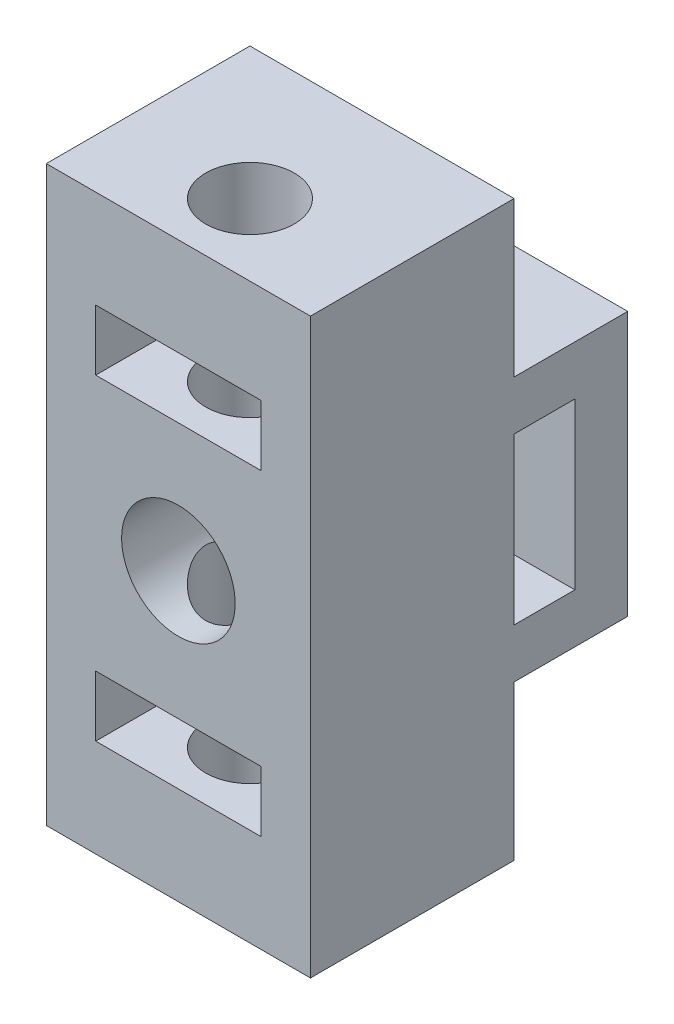
from build123d import *

# Parameters (mm, degrees)
SKETCH1_W               = 10
SKETCH1_H               = 10
BOSS_EXTRUDE1_DEPTH     = 5
CUT_EXTRUDE1_DEPTH      = 9.660254038
CUT_EXTRUDE1_DEPTH_BACK = 9.660254038
SKETCH2_R               = 1.675
SKETCH3_R               = 1.675
CUT_EXTRUDE3_DEPTH      = 2.3
SKETCH4_W               = 10
SKETCH4_H               = 10
BOSS_EXTRUDE2_DEPTH     = 2.7
SKETCH6_W               = 10
SKETCH6_H               = 10
BOSS_EXTRUDE3_DEPTH     = 7
SKETCH9_R               = 2.15
CUT_EXTRUDE12_DEPTH     = 19.468622038
SKETCH10_R              = 1.675
CUT_EXTRUDE13_DEPTH     = 13.003749414
BOSS_EXTRUDE4_DEPTH     = 2.3
SKETCH12_W              = 10
SKETCH12_H              = 10
BOSS_EXTRUDE5_DEPTH     = 2.7
CUT_EXTRUDE14_START     = -2.7
SKETCH13_R              = 1.675
CUT_EXTRUDE14_DEPTH     = 2.7
SKETCH14_R              = 2.15
BOSS_EXTRUDE6_DEPTH     = 0.76
SKETCH16_W              = 10
SKETCH16_H              = 19.7
CUT_EXTRUDE15_DEPTH     = 2.29
BOSS_EXTRUDE7_START     = 1
SKETCH17_W              = 10
SKETCH17_H              = 7.71
SKETCH17_R              = 1.675
BOSS_EXTRUDE7_DEPTH     = 1
SKETCH18_W              = 10
SKETCH18_H              = 7.71
SKETCH18_R              = 1.675
BOSS_EXTRUDE9_DEPTH     = 1
BOSS_EXTRUDE13_DEPTH    = 2.3
SKETCH23_W              = 10
SKETCH23_H              = 10
SKETCH23_R              = 1.675
BOSS_EXTRUDE15_DEPTH    = 2


with BuildPart() as part:
    # Sketch1 → Boss-Extrude1 (new body)
    with BuildSketch(Plane(origin=(0, 0, 0), x_dir=(1, 0, 0), z_dir=(0, 1, 0))):
        Rectangle(SKETCH1_W, SKETCH1_H)
    extrude(amount=BOSS_EXTRUDE1_DEPTH)

    # Sketch2 → Cut-Extrude1 (cut, two sides: drawn at the far end of the back side and taken through both)
    with BuildSketch(Plane(origin=(0, 5, 0), x_dir=(1, 0, 0), z_dir=(0, 1, 0)).offset(-CUT_EXTRUDE1_DEPTH_BACK)):
        with Locations(Location((0, 0, 0), (0, 0, 270))):
            Circle(SKETCH2_R)
    extrude(amount=CUT_EXTRUDE1_DEPTH + CUT_EXTRUDE1_DEPTH_BACK, mode=Mode.SUBTRACT)

    # Sketch3 → Cut-Extrude3 (cut)
    # profile 1 of 2: a face of its own
    with BuildSketch(Plane(origin=(0, 5, 0), x_dir=(1, 0, 0), z_dir=(0, 1, 0))):
        Polygon((-1.56461923, -2.71), (1.56461923, -2.71), (3.129238459, 0), (1.56461923, 2.71), (-1.56461923, 2.71), (-3.129238459, 0), align=None)
        with Locations(Location((0, 0, 0), (0, 0, 270))):
            Circle(SKETCH3_R, mode=Mode.SUBTRACT)
    # profile 2 of 2: a face of its own
    with BuildSketch(Plane(origin=(0, 5, 0), x_dir=(1, 0, 0), z_dir=(0, 1, 0))):
        Polygon((-1.56461923, -2.71), (-3.129238459, 0), (-3.129238459, -5), (3.129238459, -5), (3.129238459, 0), (1.56461923, -2.71), align=None)
    extrude(amount=-CUT_EXTRUDE3_DEPTH, mode=Mode.SUBTRACT)

    # Sketch4 → Boss-Extrude2 (add)
    with BuildSketch(Plane(origin=(0, 5, 0), x_dir=(1, 0, 0), z_dir=(0, 1, 0))):
        Rectangle(SKETCH4_W, SKETCH4_H)
    extrude(amount=BOSS_EXTRUDE2_DEPTH)

    # Sketch6 → Boss-Extrude3 (add)
    with BuildSketch(Plane(origin=(0, 7.7, 0), x_dir=(1, 0, 0), z_dir=(0, 1, 0))):
        Rectangle(SKETCH6_W, SKETCH6_H)
    extrude(amount=BOSS_EXTRUDE3_DEPTH)

    # Sketch9 → Cut-Extrude12 (cut, through all)
    with BuildSketch(Plane(origin=(0, 0, -5), x_dir=(-1, 0, 0), z_dir=(0, 0, -1))):
        with Locations((0, 9.85)):
            Circle(SKETCH9_R)
    extrude(amount=-CUT_EXTRUDE12_DEPTH, mode=Mode.SUBTRACT)

    # Sketch10 → Cut-Extrude13 (cut, through all)
    with BuildSketch(Plane.XZ.offset(-5)):
        with Locations(Location((0, 0, 0), (0, 0, 90))):
            Circle(SKETCH10_R)
    extrude(amount=-CUT_EXTRUDE13_DEPTH, mode=Mode.SUBTRACT)

    # Sketch11 → Boss-Extrude4 (add)
    with BuildSketch(Plane(origin=(0, 14.7, 0), x_dir=(1, 0, 0), z_dir=(0, 1, 0))):
        Polygon((1.56461923, 2.71), (3.129238459, 0), (3.129238459, -5), (5, -5), (5, 5), (-5, 5), (-5, -5), (-3.129238459, -5), (-3.129238459, 0), (-1.56461923, 2.71), align=None)
    extrude(amount=BOSS_EXTRUDE4_DEPTH)

    # Sketch12 → Boss-Extrude5 (add)
    with BuildSketch(Plane(origin=(0, 17, 0), x_dir=(1, 0, 0), z_dir=(0, 1, 0))):
        Rectangle(SKETCH12_W, SKETCH12_H)
    extrude(amount=BOSS_EXTRUDE5_DEPTH)

    # Sketch13 → Cut-Extrude14 (cut)
    with BuildSketch(Plane(origin=(0, 19.7, 0), x_dir=(1, 0, 0), z_dir=(0, 1, 0)).offset(CUT_EXTRUDE14_START)):
        with Locations(Location((0, 0, 0), (0, 0, 270))):
            Circle(SKETCH13_R)
    extrude(amount=CUT_EXTRUDE14_DEPTH, mode=Mode.SUBTRACT)

    # Sketch16 → Cut-Extrude15 (cut)
    with BuildSketch(Plane.XY.offset(5)):
        with Locations((0, 9.85)):
            Rectangle(SKETCH16_W, SKETCH16_H)
    extrude(amount=-CUT_EXTRUDE15_DEPTH, mode=Mode.SUBTRACT)

    # Sketch17 → Boss-Extrude7 (add)
    with BuildSketch(Plane(origin=(0, 0, 0), x_dir=(-1, 0, 0), z_dir=(0, -1, 0)).offset(BOSS_EXTRUDE7_START)):
        with Locations((0, 1.145)):
            Rectangle(SKETCH17_W, SKETCH17_H)
        with Locations(Location((0, 0, 0), (0, 0, 270))):
            Circle(SKETCH17_R, mode=Mode.SUBTRACT)
    extrude(amount=-BOSS_EXTRUDE7_DEPTH)

    # Sketch18 → Boss-Extrude9 (add)
    with BuildSketch(Plane(origin=(0, 19.7, 0), x_dir=(1, 0, 0), z_dir=(0, 1, 0))):
        with Locations((0, 1.145)):
            Rectangle(SKETCH18_W, SKETCH18_H)
        with Locations(Location((0, 0, 0), (0, 0, 270))):
            Circle(SKETCH18_R, mode=Mode.SUBTRACT)
    extrude(amount=BOSS_EXTRUDE9_DEPTH)


with BuildPart() as body_2:
    # Sketch14 → Boss-Extrude6 (new body)
    with BuildSketch(Plane(origin=(0, 0, -5), x_dir=(-1, 0, 0), z_dir=(0, 0, -1))):
        with Locations((0, 9.85)):
            Circle(SKETCH14_R)
    extrude(amount=-BOSS_EXTRUDE6_DEPTH)


    add(part.part)  # Boss-Extrude13 merges part
    # Sketch22 → Boss-Extrude13 (add)
    with BuildSketch(Plane(origin=(0, 0, -5), x_dir=(-1, 0, 0), z_dir=(0, 0, -1))):
        Polygon((-5, 12.979238459), (0, 12.979238459), (2.71, 11.41461923), (2.71, 8.28538077), (0, 6.720761541), (-5, 6.720761541), (-5, 4.85), (5, 4.85), (5, 14.85), (-5, 14.85), align=None)
    extrude(amount=BOSS_EXTRUDE13_DEPTH)

    # Sketch23 → Boss-Extrude15 (add)
    with BuildSketch(Plane(origin=(0, 0, -7.3), x_dir=(-1, 0, 0), z_dir=(0, 0, -1))):
        with Locations((0, 9.85)):
            Rectangle(SKETCH23_W, SKETCH23_H)
        with Locations((0, 9.85)):
            Circle(SKETCH23_R, mode=Mode.SUBTRACT)
    extrude(amount=BOSS_EXTRUDE15_DEPTH)


solid = body_2.part
